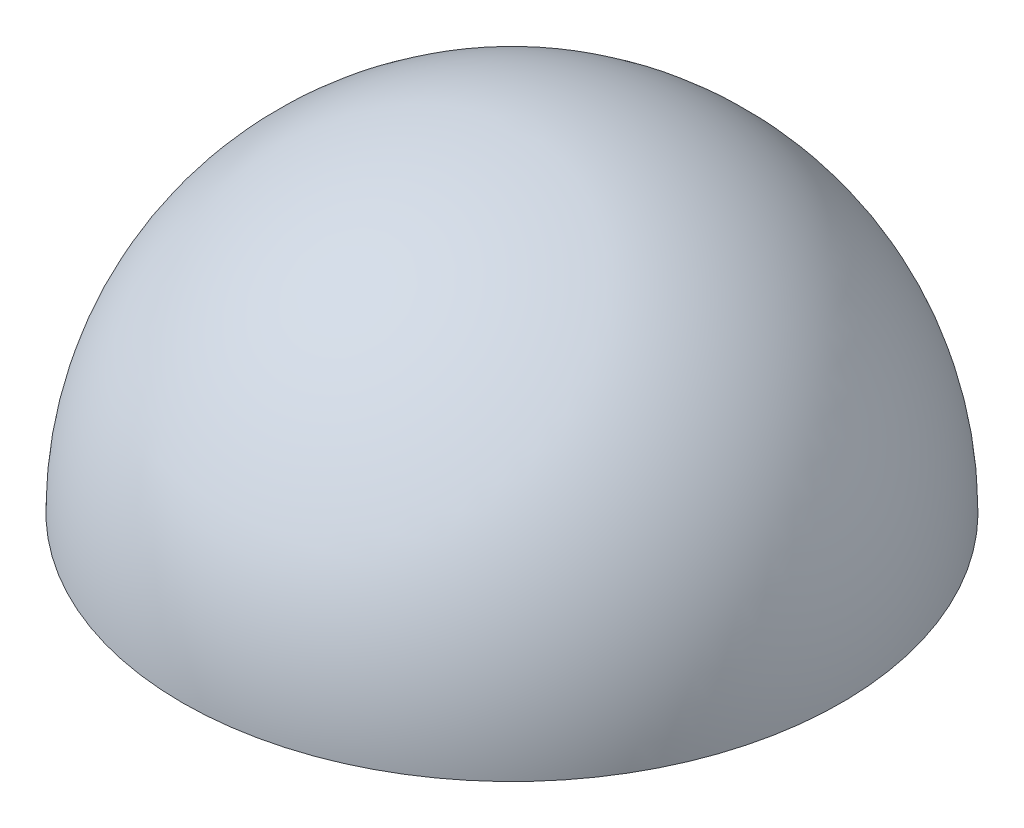
from build123d import *

# Parameters (mm, degrees)
REVOLVE1_ANGLE     = 180
SKETCH2_W          = 3
SKETCH2_H          = 3
CUT_EXTRUDE1_DEPTH = 6


with BuildPart() as part:
    # Sketch1 → Revolve1 (revolve)
    with BuildSketch(Plane(origin=(0, 76.75, 0), x_dir=(-1, 0, 0), z_dir=(0, -1, 0))):
        with BuildLine():
            Line((-13.5, -0.25), (7, -0.25))
            ThreePointArc((7, -0.25), (-3.25, -10.5), (-13.5, -0.25))
        make_face()
    revolve(axis=Axis((13.5, 76.75, 0.25), (-1, 0, 0)), revolution_arc=REVOLVE1_ANGLE)

    # Sketch2 → Cut-Extrude1 (cut)
    with BuildSketch(Plane.XZ.offset(-76.75)):
        with Locations((3.25, 0.25)):
            Rectangle(SKETCH2_W, SKETCH2_H)
    extrude(amount=-CUT_EXTRUDE1_DEPTH, mode=Mode.SUBTRACT)


solid = part.part
